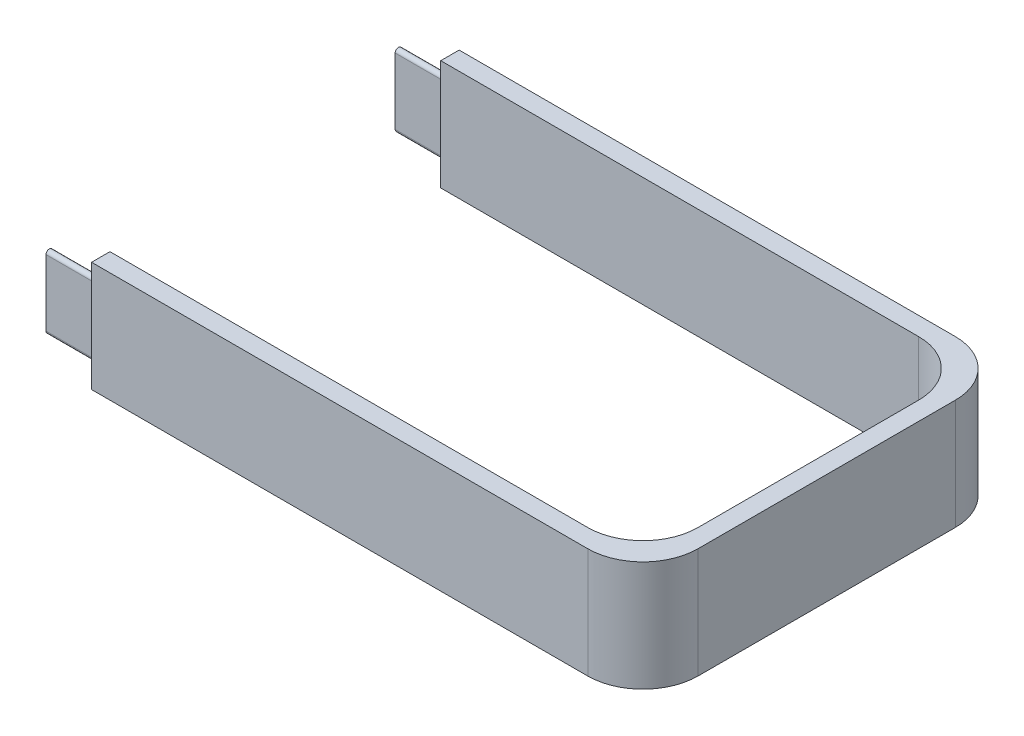
from build123d import *

# Parameters (mm, degrees)
BOSS_EXTRUDE1_DEPTH      = 30
BOSS_EXTRUDE2_DEPTH      = 10
BOSS_EXTRUDE2_DEPTH_BACK = 10
SKETCH3_W                = 170
SKETCH3_H                = 100
CUT_EXTRUDE1_DEPTH       = 40
BOSS_EXTRUDE3_DEPTH      = 14


with BuildPart() as part:
    # Sketch1 → Boss-Extrude1 (new body)
    with BuildSketch(Plane(origin=(0, 0, 0), x_dir=(1, 0, 0), z_dir=(0, 1, 0))):
        with BuildLine():
            Line((0, 0), (305, 0))
            ThreePointArc((305, 0), (315.606601718, 4.393398282), (320, 15))
            Line((320, 15), (320, 85))
            ThreePointArc((320, 85), (315.606601718, 95.606601718), (305, 100))
            Line((305, 100), (2.5, 100))
            ThreePointArc((2.5, 100), (0.732233047, 99.267766953), (0, 97.5))
            Line((0, 97.5), (0, 0))
        make_face()
        with BuildLine():
            Line((20, 95), (300, 95))
            ThreePointArc((300, 95), (310.606601718, 90.606601718), (315, 80))
            Line((315, 80), (315, 20))
            ThreePointArc((315, 20), (310.606601718, 9.393398282), (300, 5))
            Line((300, 5), (20, 5))
            ThreePointArc((20, 5), (9.393398282, 9.393398282), (5, 20))
            Line((5, 20), (5, 80))
            ThreePointArc((5, 80), (9.393398282, 90.606601718), (20, 95))
        make_face(mode=Mode.SUBTRACT)
    extrude(amount=BOSS_EXTRUDE1_DEPTH)

    # Sketch2 → Boss-Extrude2 (add, two sides: drawn at the far end of the back side and taken through both)
    with BuildSketch(Plane.XY.offset(-50).offset(-BOSS_EXTRUDE2_DEPTH_BACK)):
        Polygon((315, 0), (315, 5), (312.5, 2.5), align=None)
    extrude(amount=BOSS_EXTRUDE2_DEPTH + BOSS_EXTRUDE2_DEPTH_BACK)

    # Sketch3 → Cut-Extrude1 (cut)
    with BuildSketch(Plane(origin=(0, 0, 0), x_dir=(1, 0, 0), z_dir=(0, 1, 0))):
        with Locations((85, 50)):
            Rectangle(SKETCH3_W, SKETCH3_H)
    extrude(amount=CUT_EXTRUDE1_DEPTH, mode=Mode.SUBTRACT)

    # Sketch4 → Boss-Extrude3 (add)
    with BuildSketch(Plane(origin=(170, 0, 0), x_dir=(0, 0, -1), z_dir=(1, 0, 0))):
        with BuildLine():
            ThreePointArc((98.4, 24), (98.136396103, 24.636396103), (97.5, 24.9))
            Line((97.5, 24.9), (97.5, 5.1))
            ThreePointArc((97.5, 5.1), (98.136396103, 5.363603897), (98.4, 6))
            Line((98.4, 6), (98.4, 24))
        make_face()
        with BuildLine():
            Line((97.5, 5.1), (97.5, 24.9))
            ThreePointArc((97.5, 24.9), (96.863603897, 24.636396103), (96.6, 24))
            Line((96.6, 24), (96.6, 6))
            ThreePointArc((96.6, 6), (96.863603897, 5.363603897), (97.5, 5.1))
        make_face()
        with BuildLine():
            ThreePointArc((3.4, 24), (3.136396103, 24.636396103), (2.5, 24.9))
            Line((2.5, 24.9), (2.5, 5.1))
            ThreePointArc((2.5, 5.1), (3.136396103, 5.363603897), (3.4, 6))
            Line((3.4, 6), (3.4, 24))
        make_face()
        with BuildLine():
            Line((2.5, 5.1), (2.5, 24.9))
            ThreePointArc((2.5, 24.9), (1.863603897, 24.636396103), (1.6, 24))
            Line((1.6, 24), (1.6, 6))
            ThreePointArc((1.6, 6), (1.863603897, 5.363603897), (2.5, 5.1))
        make_face()
    extrude(amount=-BOSS_EXTRUDE3_DEPTH)


solid = part.part
